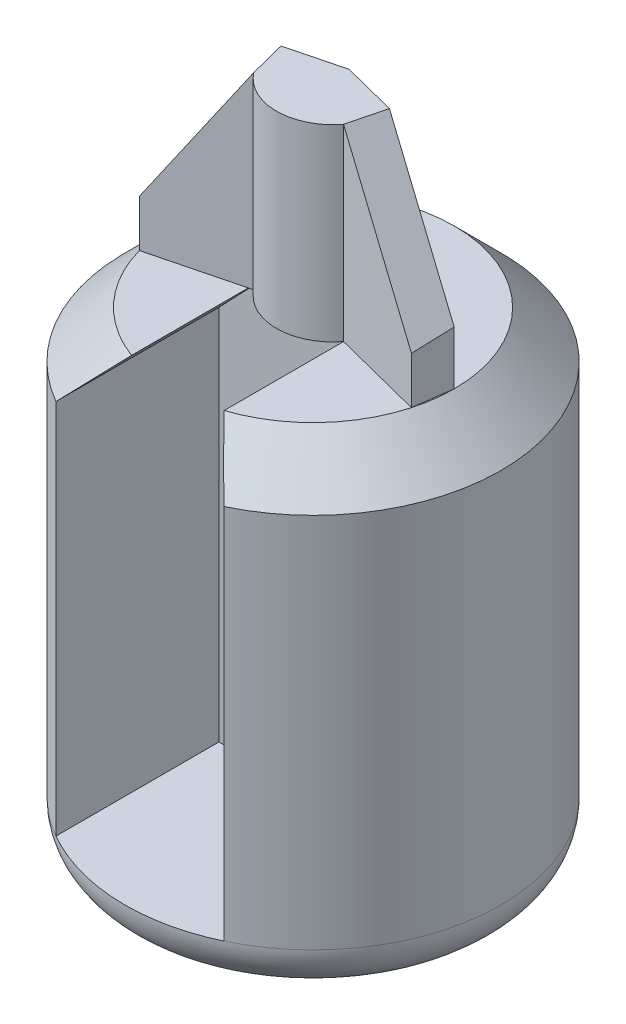
from build123d import *

# Parameters (mm, degrees)
SKETCH1_R           = 50.8
BOSS_EXTRUDE1_DEPTH = 127
FILLET2_R           = 12.7
CHAMFER1_SIZE       = 12.7
BOSS_EXTRUDE2_DEPTH = 50.8
CUT_EXTRUDE2_DEPTH  = 193.012728369
CUT_EXTRUDE3_DEPTH  = 193.012728396
BOSS_EXTRUDE3_DEPTH = 50.8
CUT_EXTRUDE4_REACH  = 193.766


with BuildPart() as part:
    # Sketch1 → Boss-Extrude1 (new body)
    with BuildSketch(Plane(origin=(0, 0, 0), x_dir=(1, 0, 0), z_dir=(0, 1, 0))):
        with Locations(Location((0, 0, 0), (0, 0, 270))):
            Circle(SKETCH1_R)
    extrude(amount=BOSS_EXTRUDE1_DEPTH)

    # Fillet2
    fillet2_edges = [part.edges().sort_by_distance(p)[0] for p in [
        (0, 0, -50.8),
    ]]
    fillet(fillet2_edges, radius=FILLET2_R)

    # Chamfer1
    chamfer1_edges = [part.edges().sort_by_distance(p)[0] for p in [
        (0, 127, -50.8),
    ]]
    chamfer(chamfer1_edges, length=CHAMFER1_SIZE)

    # Sketch2 → Boss-Extrude2 (add)
    with BuildSketch(Plane(origin=(0, 127, 0), x_dir=(1, 0, 0), z_dir=(0, 1, 0))):
        Polygon((0, 9.725532547), (-38.1, -4.635e-06), (-36.720352746, -10.160004635), (0, -0.786640962), (36.720352746, -10.160004635), (38.1, -4.635e-06), align=None)
    extrude(amount=BOSS_EXTRUDE2_DEPTH)

    # Sketch3 → Cut-Extrude2 (cut, through all)
    with BuildSketch(Plane(origin=(0.18851702, 0, 0.738519458), x_dir=(0.9689306468108195, 0, -0.24733257300801867), z_dir=(0.2473325730080187, 0, 0.9689306468108196))):
        Polygon((-38.092375226, 139.7), (-38.092375226, 177.8), (-12.692375226, 177.8), align=None)
    extrude(amount=-CUT_EXTRUDE2_DEPTH, mode=Mode.SUBTRACT)

    # Sketch4 → Cut-Extrude3 (cut, through all)
    with BuildSketch(Plane(origin=(-0.18851702, 0, 0.738519458), x_dir=(0.9689306468108199, 0, 0.24733257300801748), z_dir=(-0.24733257300801748, 0, 0.9689306468108199))):
        Polygon((12.692375226, 177.8), (38.092375226, 177.8), (38.092375226, 139.7), align=None)
    extrude(amount=-CUT_EXTRUDE3_DEPTH, mode=Mode.SUBTRACT)

    # Sketch5 → Boss-Extrude3 (add)
    with BuildSketch(Plane(origin=(0, 127, 0), x_dir=(1, 0, 0), z_dir=(0, 1, 0))):
        with BuildLine():
            Line((-12.109514317, -3.87775728), (0, -0.786640962))
            Line((0, -0.786640962), (12.109514317, -3.87775728))
            ThreePointArc((12.109514317, -3.87775728), (0, -9.864797592), (-12.109514317, -3.87775728))
        make_face()
    extrude(amount=BOSS_EXTRUDE3_DEPTH)

    # Sketch6 → Cut-Extrude4 (cut, up to next)
    with BuildSketch(Plane.XY, mode=Mode.PRIVATE) as cut_extrude4_sk1:
        Polygon((-13.290485683, 127), (-25.4, 114.3), (-25.4, 12.7), (21.819967816, 12.7), (21.819967816, 114.3), (12.109514317, 127), align=None)
    cut_extrude4_tool1 = extrude(cut_extrude4_sk1.sketch, amount=CUT_EXTRUDE4_REACH, mode=Mode.PRIVATE) & part.part
    add(cut_extrude4_tool1.solids().sort_by_distance((-1.74269, 68.455742, 0))[0], mode=Mode.SUBTRACT)


solid = part.part
